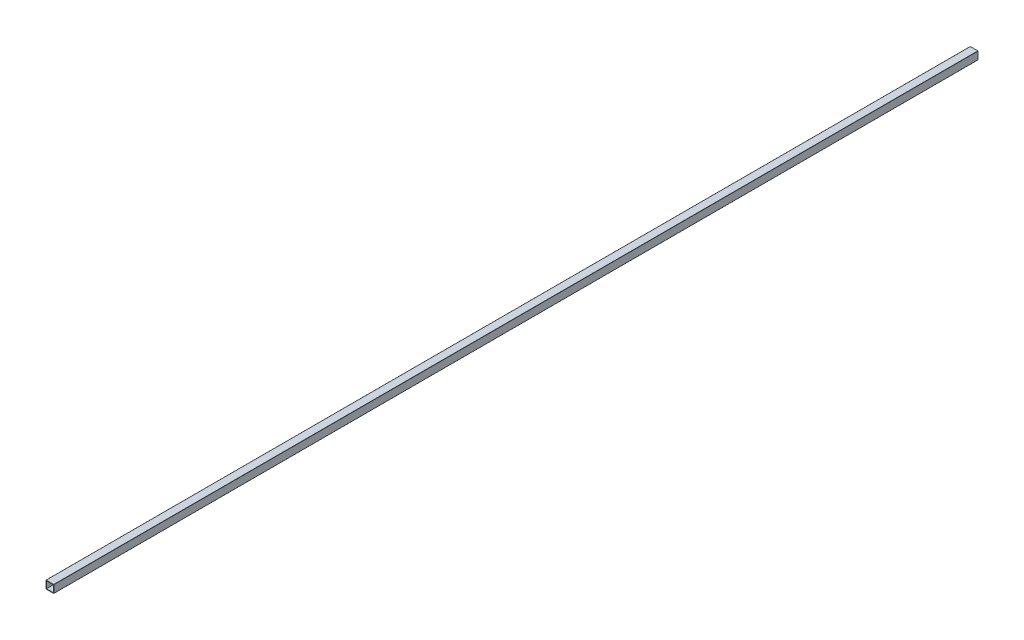
from build123d import *

# Parameters (mm, degrees)
CROQUIS1_W              = 44.72
CROQUIS1_H              = 44.72
SALIENTE_EXTRUIR1_DEPTH = 6000


with BuildPart() as part:
    # Croquis1 → Saliente-Extruir1 (new body)
    with BuildSketch(Plane.XY):
        with BuildLine():
            Line((-24.4, -25.4), (24.4, -25.4))
            ThreePointArc((24.4, -25.4), (25.107106781, -25.107106781), (25.4, -24.4))
            Line((25.4, -24.4), (25.4, 24.4))
            ThreePointArc((25.4, 24.4), (25.107106781, 25.107106781), (24.4, 25.4))
            Line((24.4, 25.4), (-24.4, 25.4))
            ThreePointArc((-24.4, 25.4), (-25.107106781, 25.107106781), (-25.4, 24.4))
            Line((-25.4, 24.4), (-25.4, -24.4))
            ThreePointArc((-25.4, -24.4), (-25.107106781, -25.107106781), (-24.4, -25.4))
        make_face()
        Rectangle(CROQUIS1_W, CROQUIS1_H, mode=Mode.SUBTRACT)
    extrude(amount=SALIENTE_EXTRUIR1_DEPTH)


solid = part.part
